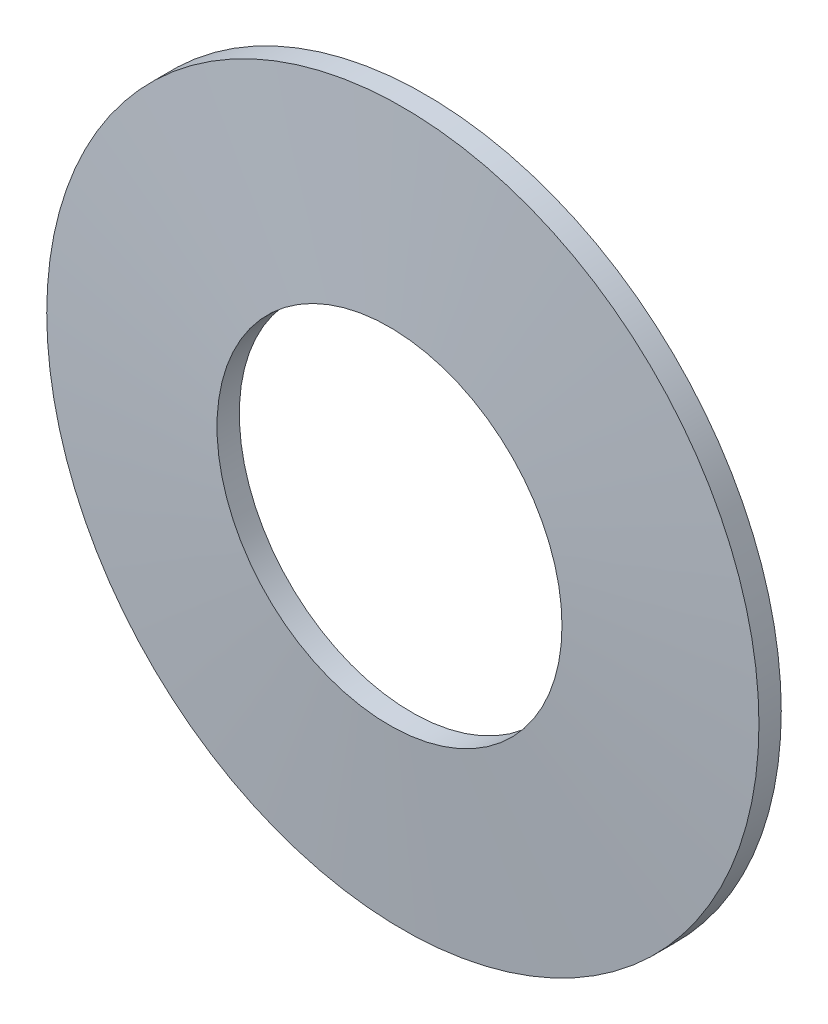
from build123d import *


with BuildPart() as part:
    # Esquisse1 → Révolution1 (revolve)
    with BuildSketch(Plane(origin=(0, 0, 0), x_dir=(0, 0, -1), z_dir=(1, 0, 0))):
        Polygon((-2, 7.75), (-1.4, 16), (-0.39735886, 16), (-0.99735886, 7.75), align=None)
    revolve(axis=Axis((0, 0, 13.8176), (0, 0, -1)))


solid = part.part
